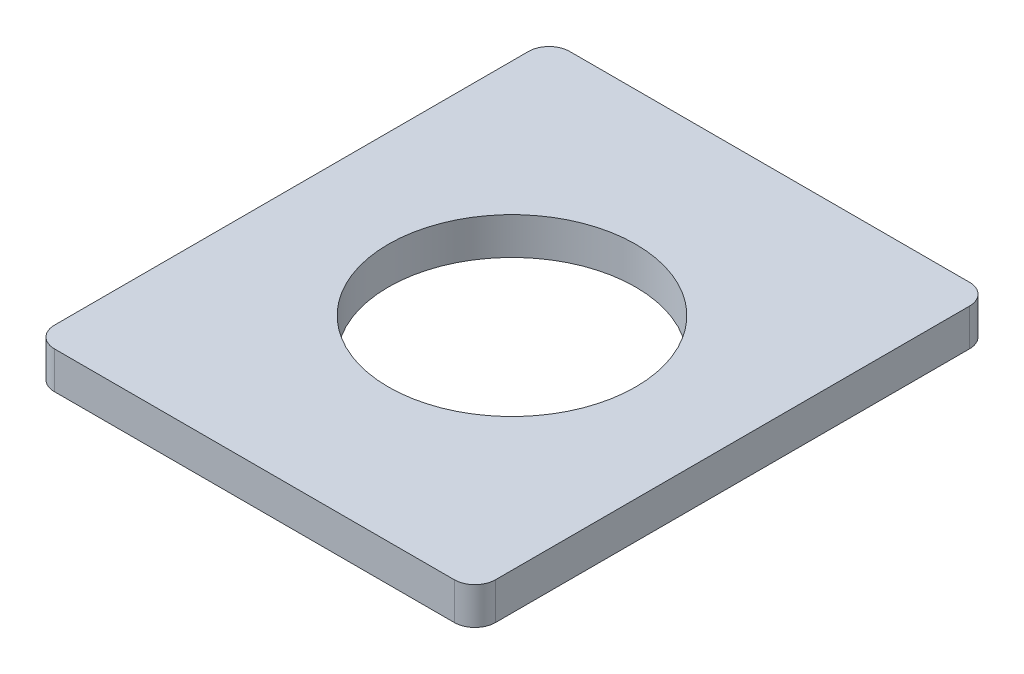
from build123d import *

# Parameters (mm, degrees)
SKETCH_1_W      = 214
SKETCH_1_H      = 250
SKETCH_1_R      = 60
EXTRUDE_1_DEPTH = 18
FILLET_1_R      = 10


with BuildPart() as part:
    # 草图1 → 凸台-拉伸1 (new body)
    with BuildSketch(Plane(origin=(0, 0, 0), x_dir=(1, 0, 0), z_dir=(0, 1, 0))):
        Rectangle(SKETCH_1_W, SKETCH_1_H)
        with Locations(Location((0, 0, 0), (0, 0, 270))):
            Circle(SKETCH_1_R, mode=Mode.SUBTRACT)
    extrude(amount=EXTRUDE_1_DEPTH)

    # 圆角1
    fillet_1_edges = [part.edges().sort_by_distance(p)[0] for p in [
        (-107, 9, -125),
        (107, 9, -125),
        (107, 9, 125),
        (-107, 9, 125),
    ]]
    fillet(fillet_1_edges, radius=FILLET_1_R)


solid = part.part
